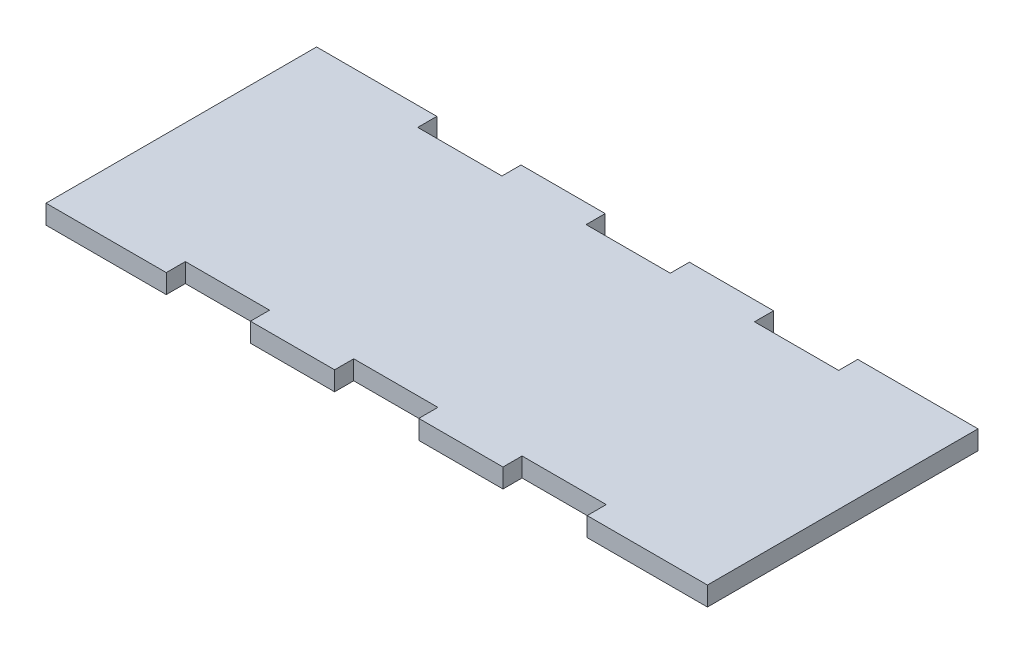
from build123d import *

# Parameters (mm, degrees)
BOSS_EXTRUDE1_DEPTH = 3.175


with BuildPart() as part:
    # Sketch3 → Boss-Extrude1 (new body)
    with BuildSketch(Plane(origin=(0, 0, 0), x_dir=(1, 0, 0), z_dir=(0, 1, 0))):
        Polygon((62, 3.175), (62, 0), (76, 0), (76, 3.175), (90, 3.175), (90, 0), (110, 0), (110, 45), (90, 45), (90, 41.825), (76, 41.825), (76, 45), (62, 45), (62, 41.825), (48, 41.825), (48, 45), (34, 45), (34, 41.825), (20, 41.825), (20, 45), (0, 45), (0, 0), (20, 0), (20, 3.175), (34, 3.175), (34, 0), (48, 0), (48, 3.175), align=None)
    extrude(amount=BOSS_EXTRUDE1_DEPTH)


solid = part.part
